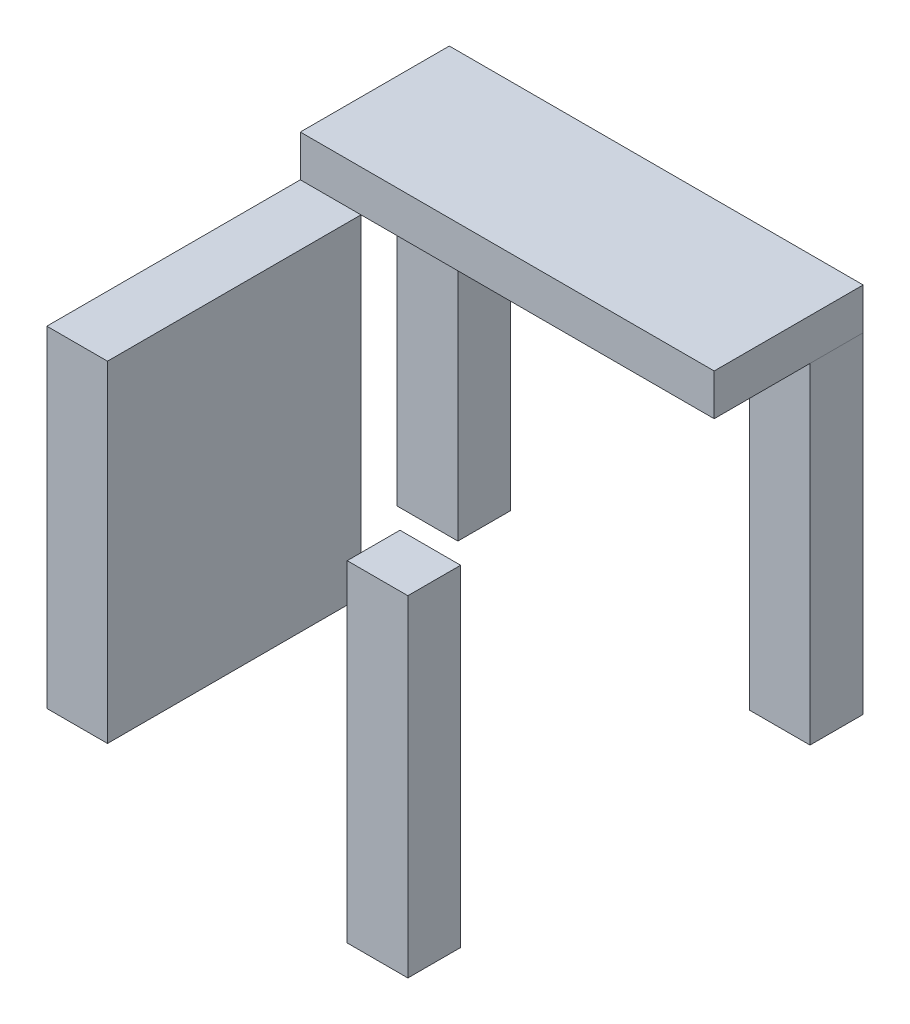
from build123d import *

# Parameters (mm, degrees)
SKETCH1_W           = 100
SKETCH1_H           = 10
BOSS_EXTRUDE1_DEPTH = 36
SKETCH2_W           = 14.657296337
SKETCH2_H           = 12.750406224
SKETCH2_H_2         = 61.249593776
SKETCH2_W_2         = 14.657296336
BOSS_EXTRUDE2_DEPTH = 80


with BuildPart() as part:
    # Sketch1 → Boss-Extrude1 (new body)
    with BuildSketch(Plane.XY):
        with Locations((50, 5)):
            Rectangle(SKETCH1_W, SKETCH1_H)
    extrude(amount=BOSS_EXTRUDE1_DEPTH)

    # Sketch2 → Boss-Extrude2 (add)
    with BuildSketch(Plane.XZ):
        with Locations((92.690459103, 103.659485129)):
            Rectangle(SKETCH2_W, SKETCH2_H)
        with Locations((7.328648169, 66.624796888)):
            Rectangle(SKETCH2_W, SKETCH2_H_2)
        with Locations((7.309540898, 6.193559762)):
            Rectangle(SKETCH2_W, SKETCH2_H)
        with Locations((92.543503994, 6.340514871)):
            Rectangle(SKETCH2_W_2, SKETCH2_H)
    extrude(amount=BOSS_EXTRUDE2_DEPTH)


with BuildPart() as boss_extrude2_piece_1:
    # of the separate pieces the step leaves, piece 1, a body of its own (boss_extrude2_pieces)
    add(part.part.solids().sort_by_distance((0, -80, 36))[0])


with BuildPart() as boss_extrude2_piece_2:
    # of the separate pieces the step leaves, piece 2, a body of its own (boss_extrude2_pieces)
    add(part.part.solids().sort_by_distance((0, 0, 12.568762874))[0])


with BuildPart() as boss_extrude2_piece_3:
    # of the separate pieces the step leaves, piece 3, a body of its own (boss_extrude2_pieces)
    add(part.part.solids().sort_by_distance((85.361810934, 0, 110.034688241))[0])


solid = Compound([boss_extrude2_piece_1.part, boss_extrude2_piece_2.part, boss_extrude2_piece_3.part])
